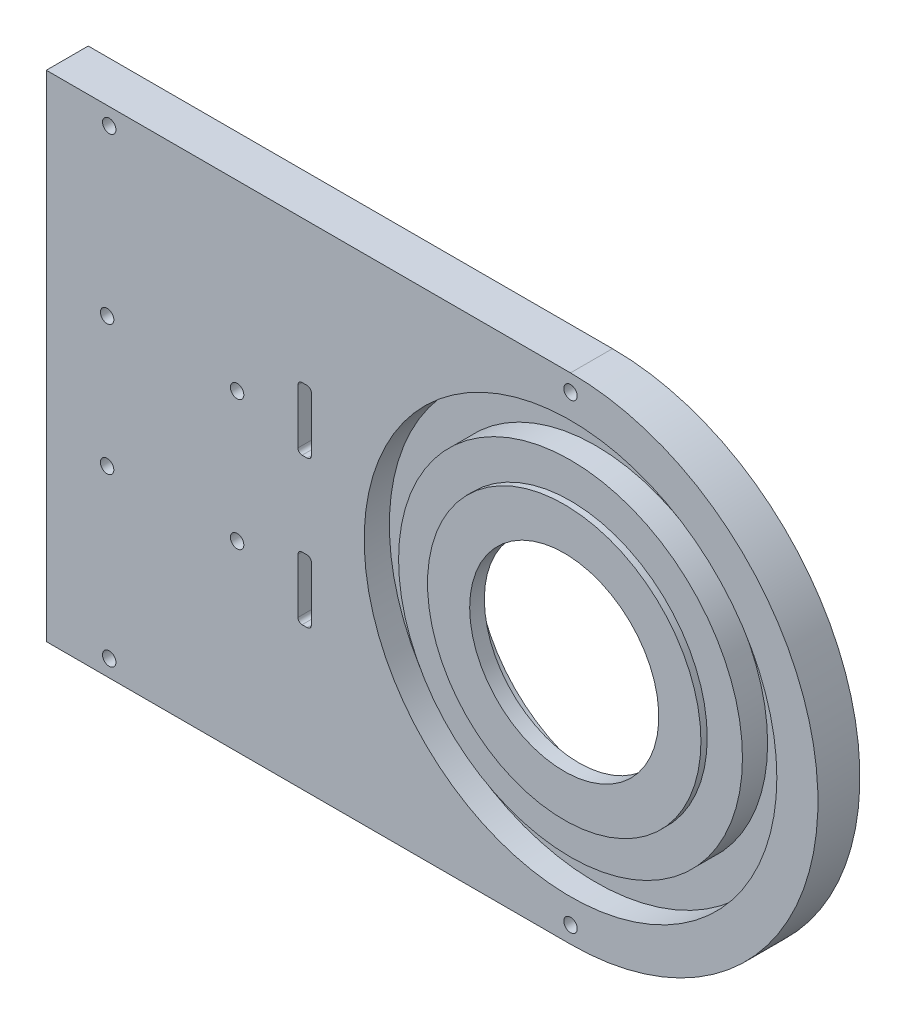
from build123d import *

# Parameters (mm, degrees)
BOSS_EXTRUDE1_DEPTH = 10
SKETCH2_R           = 32.6
BOSS_EXTRUDE2_DEPTH = 1.5
CUT_EXTRUDE1_START  = -10
SKETCH3_R           = 32.6
SKETCH3_R_2         = 22.5
CUT_EXTRUDE1_DEPTH  = 8
SKETCH6_R           = 1.6
CUT_EXTRUDE4_DEPTH  = 10
SKETCH7_R           = 8.55
CUT_EXTRUDE5_DEPTH  = 7.5
SKETCH5_R           = 49.2
SKETCH5_R_2         = 41
CUT_EXTRUDE7_DEPTH  = 6
SKETCH9_R           = 1.6
CUT_EXTRUDE8_DEPTH  = 139.702018731
SKETCH10_R          = 22.55
CUT_EXTRUDE9_DEPTH  = 139.702018731
CUT_EXTRUDE10_DEPTH = 139.702018731


with BuildPart() as part:
    # Sketch1 → Boss-Extrude1 (new body)
    with BuildSketch(Plane.XY):
        with BuildLine():
            Line((-125, 59), (0, 59))
            ThreePointArc((0, 59), (59, 0), (0, -59))
            Line((0, -59), (-125, -59))
            Line((-125, -59), (-125, 59))
        make_face()
    extrude(amount=BOSS_EXTRUDE1_DEPTH)

    # Sketch2 → Boss-Extrude2 (add)
    with BuildSketch(Plane.XY.offset(10)):
        Circle(SKETCH2_R)
    extrude(amount=BOSS_EXTRUDE2_DEPTH)

    # Sketch3 → Cut-Extrude1 (cut)
    with BuildSketch(Plane.XY.offset(10).offset(CUT_EXTRUDE1_START)):
        Circle(SKETCH3_R)
        Circle(SKETCH3_R_2, mode=Mode.SUBTRACT)
    extrude(amount=CUT_EXTRUDE1_DEPTH, mode=Mode.SUBTRACT)

    # Sketch6 → Cut-Extrude4 (cut)
    with BuildSketch(Plane.XY.offset(10)):
        with Locations((0, -55)):
            Circle(SKETCH6_R)
        with Locations((-110, -55)):
            Circle(SKETCH6_R)
        with Locations((-110, 55)):
            Circle(SKETCH6_R)
        with Locations((0, 55)):
            Circle(SKETCH6_R)
    extrude(amount=-CUT_EXTRUDE4_DEPTH, mode=Mode.SUBTRACT)

    # Sketch7 → Cut-Extrude5 (cut)
    with BuildSketch(Plane(origin=(0, 0, 0), x_dir=(-1, 0, 0), z_dir=(0, 0, -1))):
        with Locations((95, 0)):
            Circle(SKETCH7_R)
    extrude(amount=-CUT_EXTRUDE5_DEPTH, mode=Mode.SUBTRACT)

    # Sketch5 → Cut-Extrude7 (cut)
    with BuildSketch(Plane.XY.offset(10)):
        Circle(SKETCH5_R)
        Circle(SKETCH5_R_2, mode=Mode.SUBTRACT)
    extrude(amount=-CUT_EXTRUDE7_DEPTH, mode=Mode.SUBTRACT)

    # Sketch9 → Cut-Extrude8 (cut, through all)
    with BuildSketch(Plane(origin=(0, 0, 0), x_dir=(-1, 0, 0), z_dir=(0, 0, -1))):
        with Locations((79.5, -15.5)):
            Circle(SKETCH9_R)
        with Locations((79.5, 15.5)):
            Circle(SKETCH9_R)
        with Locations((110.5, 15.5)):
            Circle(SKETCH9_R)
        with Locations((110.5, -15.5)):
            Circle(SKETCH9_R)
    extrude(amount=-CUT_EXTRUDE8_DEPTH, mode=Mode.SUBTRACT)

    # Sketch10 → Cut-Extrude9 (cut, through all)
    with BuildSketch(Plane(origin=(0, 0, 0), x_dir=(-1, 0, 0), z_dir=(0, 0, -1))):
        Circle(SKETCH10_R)
    extrude(amount=-CUT_EXTRUDE9_DEPTH, mode=Mode.SUBTRACT)

    # Sketch11 → Cut-Extrude10 (cut, through all)
    with BuildSketch(Plane(origin=(0, 0, 0), x_dir=(-1, 0, 0), z_dir=(0, 0, -1))):
        with BuildLine():
            Line((65, -24), (65, -11))
            ThreePointArc((65, -11), (64.707106781, -10.292893219), (64, -10))
            Line((64, -10), (62.8, -10))
            ThreePointArc((62.8, -10), (62.092893219, -10.292893219), (61.8, -11))
            Line((61.8, -11), (61.8, -24))
            ThreePointArc((61.8, -24), (62.092893219, -24.707106781), (62.8, -25))
            Line((62.8, -25), (64, -25))
            ThreePointArc((64, -25), (64.707106781, -24.707106781), (65, -24))
        make_face()
        with BuildLine():
            Line((62.8, 25), (64, 25))
            ThreePointArc((64, 25), (64.707106781, 24.707106781), (65, 24))
            Line((65, 24), (65, 11))
            ThreePointArc((65, 11), (64.707106781, 10.292893219), (64, 10))
            Line((64, 10), (62.8, 10))
            ThreePointArc((62.8, 10), (62.092893219, 10.292893219), (61.8, 11))
            Line((61.8, 11), (61.8, 24))
            ThreePointArc((61.8, 24), (62.092893219, 24.707106781), (62.8, 25))
        make_face()
    extrude(amount=-CUT_EXTRUDE10_DEPTH, mode=Mode.SUBTRACT)


solid = part.part
